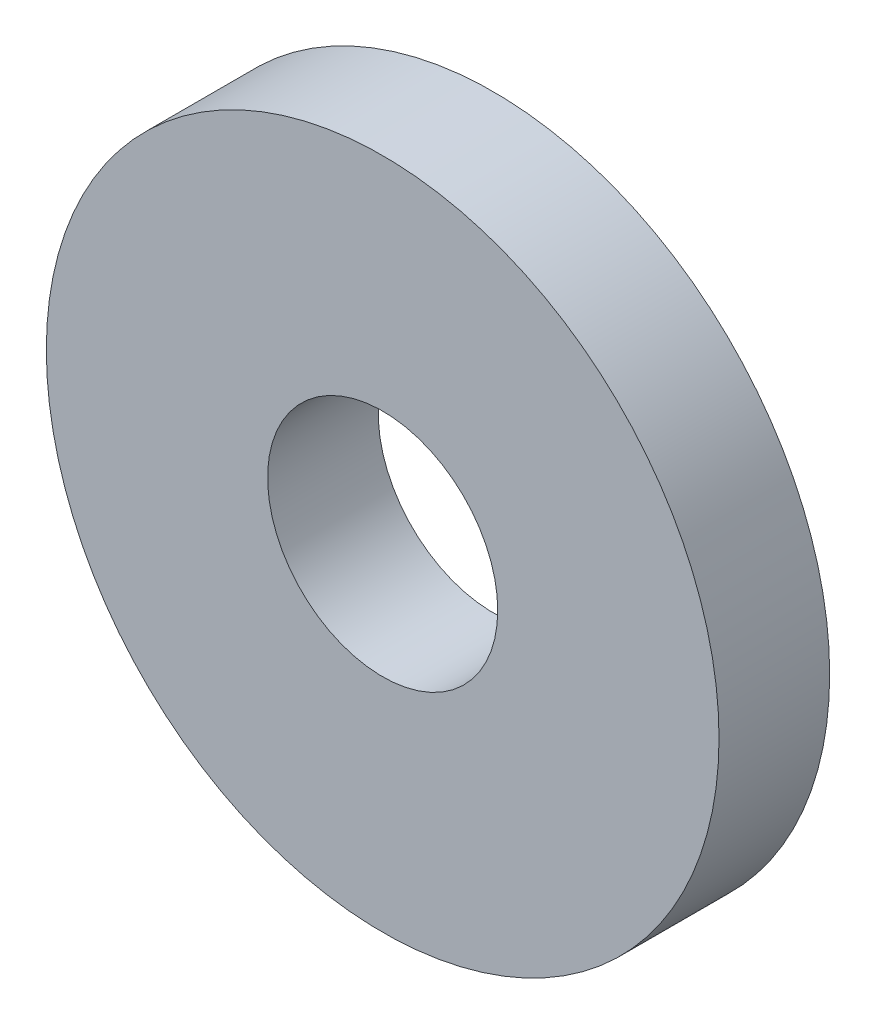
from build123d import *

# Parameters (mm, degrees)
SKETCH1_R           = 9.652
SKETCH1_R_2         = 3.302
BOSS_EXTRUDE1_DEPTH = 3.175


with BuildPart() as part:
    # Sketch1 → Boss-Extrude1 (new body)
    with BuildSketch(Plane.XY):
        Circle(SKETCH1_R)
        Circle(SKETCH1_R_2, mode=Mode.SUBTRACT)
    extrude(amount=BOSS_EXTRUDE1_DEPTH)


solid = part.part
